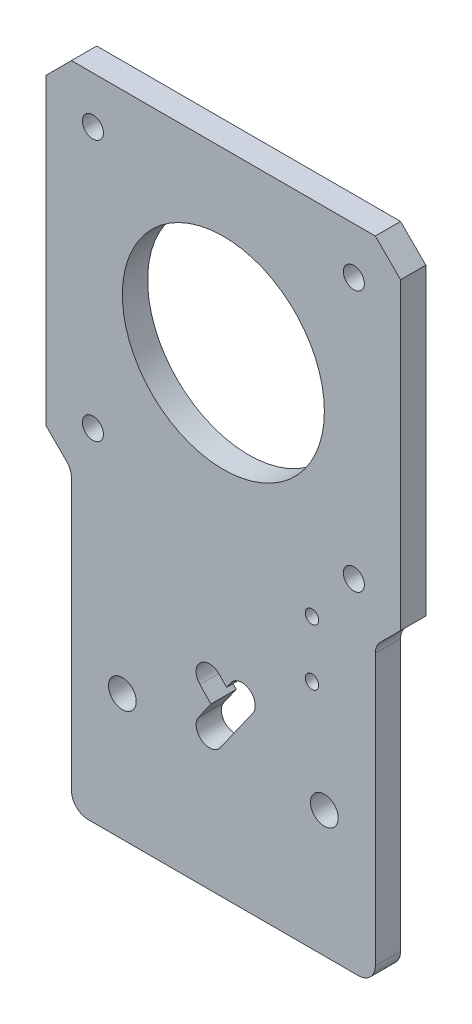
from build123d import *

# Parameters (mm, degrees)
SKETCH1_R                   = 12
BOSS_EXTRUDE1_DEPTH         = 3
TAP_DRILL_FOR_M3_TAP1_D     = 2.5
TAP_DRILL_FOR_M3_TAP1_DEPTH = 5
TAP_DRILL_FOR_M3_TAP1_TIP   = 0.751075774
TAP_DRILL_FOR_M4_TAP1_D     = 3.3
TAP_DRILL_FOR_M4_TAP1_DEPTH = 5
TAP_DRILL_FOR_M4_TAP1_TIP   = 0.991420021
FILLET1_R                   = 2
TAP_DRILL_FOR_M2_TAP1_D     = 1.6
TAP_DRILL_FOR_M2_TAP1_DEPTH = 5
TAP_DRILL_FOR_M2_TAP1_TIP   = 0.480688495
CUT_EXTRUDE1_DEPTH          = 10


with BuildPart() as part:
    # Sketch1 → Boss-Extrude1 (new body)
    with BuildSketch(Plane.XY):
        Polygon((18.05, -56.055), (18.05, -21.05), (21.05, -18.05), (21.05, 18.05), (18.05, 21.05), (-18.05, 21.05), (-21.05, 18.05), (-21.05, -18.05), (-18.05, -21.05), (-18.05, -56.055), align=None)
        Circle(SKETCH1_R, mode=Mode.SUBTRACT)
    extrude(amount=BOSS_EXTRUDE1_DEPTH)

    # Tap Drill for M3 Tap1
    with Locations(Plane.XY.offset(3)):
        with Locations((-15.5, 15.5), (15.5, 15.5), (-15.5, -15.5), (15.5, -15.5)):
            Hole(TAP_DRILL_FOR_M3_TAP1_D / 2, depth=TAP_DRILL_FOR_M3_TAP1_DEPTH)
            with Locations((0, 0, -(TAP_DRILL_FOR_M3_TAP1_DEPTH + TAP_DRILL_FOR_M3_TAP1_TIP / 2))):  # 118° drill point
                Cone(0, TAP_DRILL_FOR_M3_TAP1_D / 2, TAP_DRILL_FOR_M3_TAP1_TIP, mode=Mode.SUBTRACT)

    # Tap Drill for M4 Tap1
    with Locations(Plane.XY.offset(3)):
        with Locations((12, -41.055), (-12, -41.055)):
            Hole(TAP_DRILL_FOR_M4_TAP1_D / 2, depth=TAP_DRILL_FOR_M4_TAP1_DEPTH)
            with Locations((0, 0, -(TAP_DRILL_FOR_M4_TAP1_DEPTH + TAP_DRILL_FOR_M4_TAP1_TIP / 2))):  # 118° drill point
                Cone(0, TAP_DRILL_FOR_M4_TAP1_D / 2, TAP_DRILL_FOR_M4_TAP1_TIP, mode=Mode.SUBTRACT)

    # Fillet1
    fillet1_edges = [part.edges().sort_by_distance(p)[0] for p in [
        (18.05, -21.05, 1.5),
        (18.05, -56.055, 1.5),
        (-18.05, -56.055, 1.5),
        (-18.05, -21.05, 1.5),
    ]]
    fillet(fillet1_edges, radius=FILLET1_R)

    # Tap Drill for M2 Tap1
    with Locations(Plane.XY.offset(3)):
        with Locations((10.52945603, -21.86131015), (10.52945603, -28.56131015)):
            Hole(TAP_DRILL_FOR_M2_TAP1_D / 2, depth=TAP_DRILL_FOR_M2_TAP1_DEPTH)
            with Locations((0, 0, -(TAP_DRILL_FOR_M2_TAP1_DEPTH + TAP_DRILL_FOR_M2_TAP1_TIP / 2))):  # 118° drill point
                Cone(0, TAP_DRILL_FOR_M2_TAP1_D / 2, TAP_DRILL_FOR_M2_TAP1_TIP, mode=Mode.SUBTRACT)

    # Sketch8 → Cut-Extrude1 (cut)
    with BuildSketch(Plane.XY):
        with BuildLine():
            Line((-0.350833888, -40.786266358), (3.496510612, -35.314487513))
            ThreePointArc((3.496510612, -35.314487513), (3.110982416, -33.102773131), (0.899268034, -33.488301326))
            Line((0.899268034, -33.488301326), (0.384994593, -34.219712442))
            Line((0.384994593, -34.219712442), (-0.509366672, -33.296697877))
            ThreePointArc((-0.509366672, -33.296697877), (-2.754151719, -33.261305914), (-2.789543683, -35.506090962))
            Line((-2.789543683, -35.506090962), (-1.474067559, -36.863711947))
            Line((-1.474067559, -36.863711947), (-2.948076466, -38.96008017))
            ThreePointArc((-2.948076466, -38.96008017), (-2.562548271, -41.171794553), (-0.350833888, -40.786266358))
        make_face()
    extrude(amount=CUT_EXTRUDE1_DEPTH, mode=Mode.SUBTRACT)


solid = part.part
